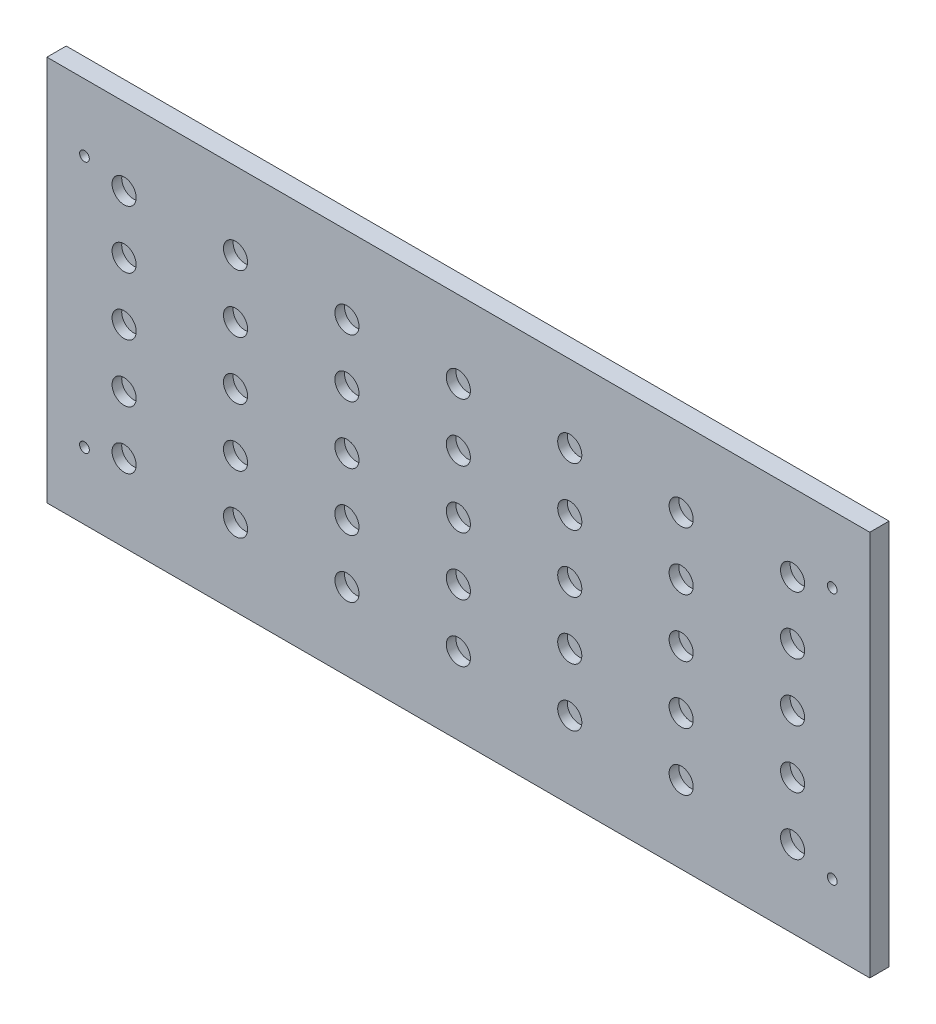
from build123d import *

# Parameters (mm, degrees)
SKETCH1_W                 = 270.7
SKETCH1_H                 = 127
SKETCH1_R                 = 1.6
WALL_DEPTH                = 6.35
SKETCH5_R                 = 3.96875
RODSUPPORTCUTOUT_DEPTH    = 3.175
SUPPORTPATTERN_COUNT      = 7
SUPPORTPATTERN_PITCH      = 36.65
SUPPORTPATTERN_COUNT_DIR2 = 5
SUPPORTPATTERN_PITCH_DIR2 = 19.05


with BuildPart() as part:
    # Sketch1 → Wall (new body)
    with BuildSketch(Plane.XY):
        with Locations((135.35, 63.5)):
            Rectangle(SKETCH1_W, SKETCH1_H)
        with Locations((12.35, 105)):
            Circle(SKETCH1_R, mode=Mode.SUBTRACT)
        with Locations(Location((258.35, 105, 0), (0, 0, 180))):
            Circle(SKETCH1_R, mode=Mode.SUBTRACT)
        with Locations((258.35, 22)):
            Circle(SKETCH1_R, mode=Mode.SUBTRACT)
        with Locations(Location((12.35, 22, 0), (0, 0, 180))):
            Circle(SKETCH1_R, mode=Mode.SUBTRACT)
    extrude(amount=WALL_DEPTH)

    # Sketch5 → RodSupportCutout (cut)
    with BuildSketch(Plane.XY.offset(6.35)):
        with Locations(Location((25.4, 101.6, 0), (0, 0, 180))):
            Circle(SKETCH5_R)
    rodsupportcutout = extrude(amount=-RODSUPPORTCUTOUT_DEPTH, mode=Mode.SUBTRACT)

    # SupportPattern: RodSupportCutout 7 × 5
    with Locations(*[(i * SUPPORTPATTERN_PITCH, -j * SUPPORTPATTERN_PITCH_DIR2, 0) for i in range(SUPPORTPATTERN_COUNT) for j in range(SUPPORTPATTERN_COUNT_DIR2) if (i, j) != (0, 0)]):
        add(rodsupportcutout, mode=Mode.SUBTRACT)


solid = part.part
